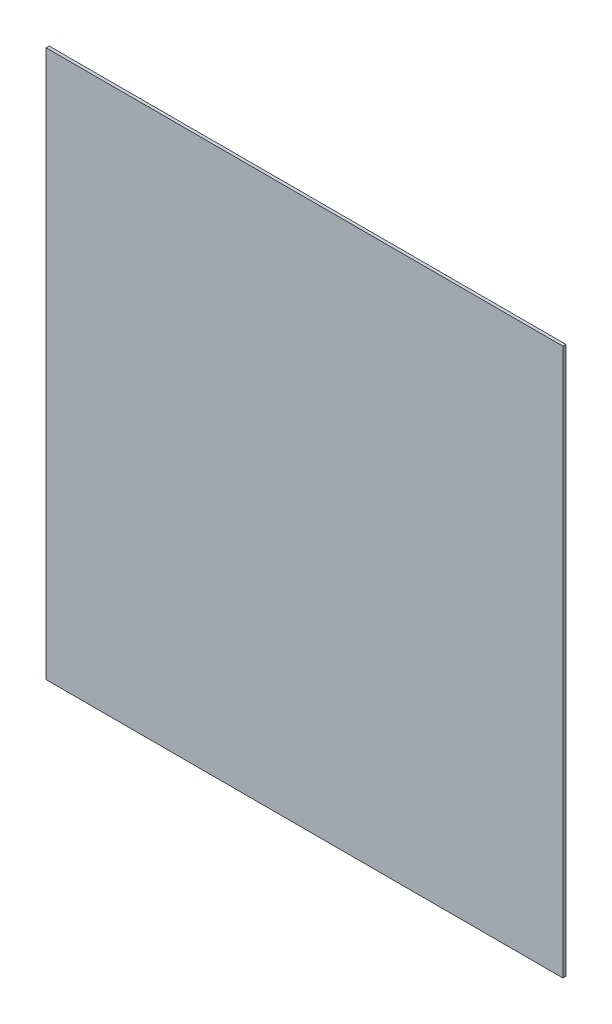
from build123d import *

# Parameters (mm, degrees)
SKETCH1_W           = 510
SKETCH1_H           = 540
BOSS_EXTRUDE1_DEPTH = 3


with BuildPart() as part:
    # Sketch1 → Boss-Extrude1 (new body)
    with BuildSketch(Plane.XY):
        Rectangle(SKETCH1_W, SKETCH1_H)
    extrude(amount=BOSS_EXTRUDE1_DEPTH)


solid = part.part
